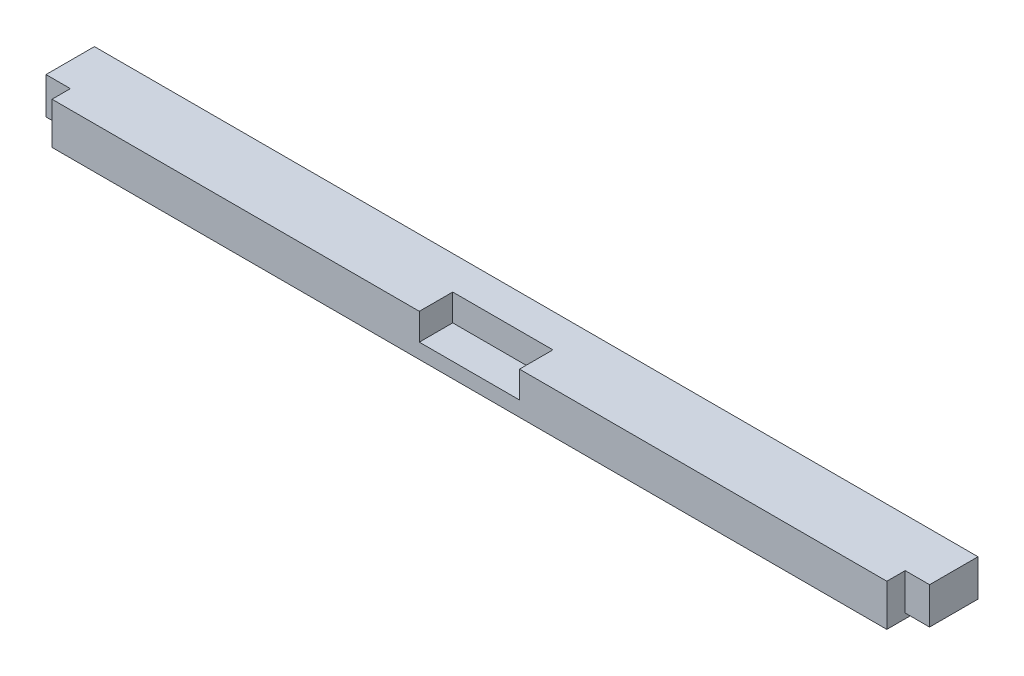
from build123d import *

# Parameters (mm, degrees)
SKETCH1_W           = 635
SKETCH1_H           = 50.8
BOSS_EXTRUDE1_DEPTH = 31.75
SKETCH2_W           = 36.83
SKETCH2_H           = 27.94
BOSS_EXTRUDE2_DEPTH = 18.542
SKETCH3_W           = 36.83
SKETCH3_H           = 27.94
BOSS_EXTRUDE3_DEPTH = 18.542
SKETCH4_W           = 76.2
SKETCH4_H           = 25.4
CUT_EXTRUDE1_DEPTH  = 20.32


with BuildPart() as part:
    # Sketch1 → Boss-Extrude1 (new body)
    with BuildSketch(Plane(origin=(0, 0, 0), x_dir=(1, 0, 0), z_dir=(0, 1, 0))):
        with Locations((317.5, 25.4)):
            Rectangle(SKETCH1_W, SKETCH1_H)
    extrude(amount=BOSS_EXTRUDE1_DEPTH)

    # Sketch2 → Boss-Extrude2 (add)
    with BuildSketch(Plane(origin=(635, 0, 0), x_dir=(0, 0, -1), z_dir=(1, 0, 0))):
        with Locations((32.385, 17.78)):
            Rectangle(SKETCH2_W, SKETCH2_H)
    extrude(amount=BOSS_EXTRUDE2_DEPTH)

    # Sketch3 → Boss-Extrude3 (add)
    with BuildSketch(Plane.ZY):
        with Locations((-32.385, 17.78)):
            Rectangle(SKETCH3_W, SKETCH3_H)
    extrude(amount=BOSS_EXTRUDE3_DEPTH)

    # Sketch4 → Cut-Extrude1 (cut)
    with BuildSketch(Plane(origin=(0, 31.75, 0), x_dir=(1, 0, 0), z_dir=(0, 1, 0))):
        with Locations((317.5, 12.7)):
            Rectangle(SKETCH4_W, SKETCH4_H)
    extrude(amount=-CUT_EXTRUDE1_DEPTH, mode=Mode.SUBTRACT)


solid = part.part
